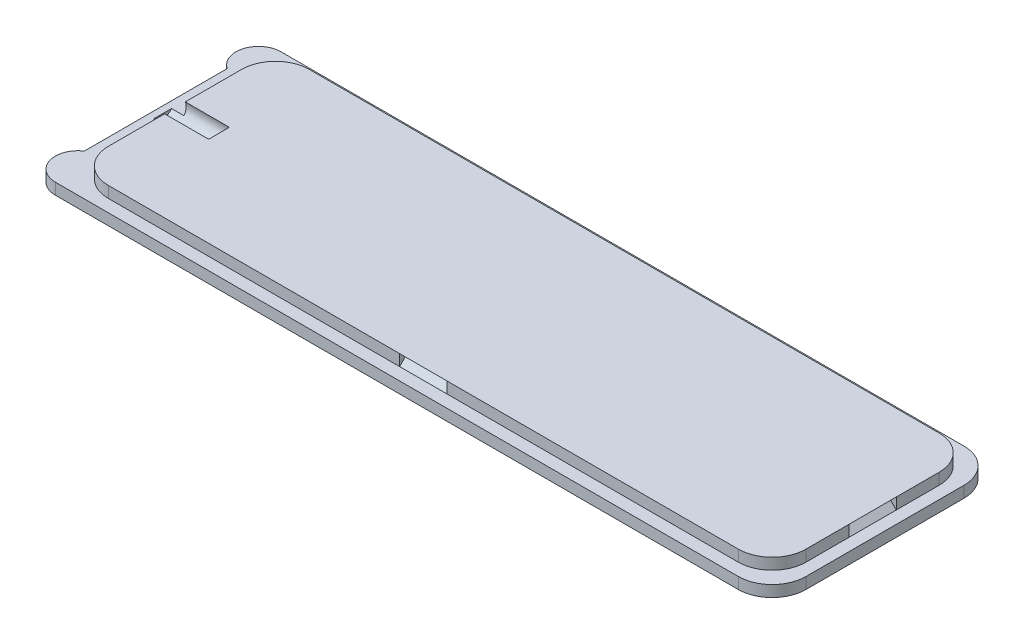
from build123d import *

# Parameters (mm, degrees)
BOSS_EXTRUDE1_DEPTH     = 10
CUT_EXTRUDE7_START      = -5
CUT_EXTRUDE7_DEPTH      = 5
CUT_EXTRUDE8_DEPTH      = 10.5
CUT_EXTRUDE8_DEPTH_BACK = 10.5
CUT_EXTRUDE9_DEPTH      = 10.5
CUT_EXTRUDE9_DEPTH_BACK = 10.5
SKETCH14_R              = 5
CUT_EXTRUDE10_DEPTH     = 25
BOSS_EXTRUDE2_DEPTH     = 5
CUT_EXTRUDE12_DEPTH     = 5


with BuildPart() as part:
    # Sketch8 → Boss-Extrude1 (new body)
    with BuildSketch(Plane(origin=(0, 0, 0), x_dir=(1, 0, 0), z_dir=(0, 1, 0))):
        with BuildLine():
            Line((15, 0), (305, 0))
            ThreePointArc((305, 0), (315.606601718, 4.393398282), (320, 15))
            Line((320, 15), (320, 85))
            ThreePointArc((320, 85), (315.606601718, 95.606601718), (305, 100))
            Line((305, 100), (15, 100))
            ThreePointArc((15, 100), (4.393398282, 95.606601718), (0, 85))
            Line((0, 85), (0, 15))
            ThreePointArc((0, 15), (4.393398282, 4.393398282), (15, 0))
        make_face()
    extrude(amount=BOSS_EXTRUDE1_DEPTH)

    # Sketch9 → Cut-Extrude7 (cut)
    with BuildSketch(Plane(origin=(0, 10, 0), x_dir=(1, 0, 0), z_dir=(0, 1, 0)).offset(CUT_EXTRUDE7_START)):
        with BuildLine():
            Line((15, 0), (305, 0))
            ThreePointArc((305, 0), (315.606601718, 4.393398282), (320, 15))
            Line((320, 15), (320, 85))
            ThreePointArc((320, 85), (315.606601718, 95.606601718), (305, 100))
            Line((305, 100), (15, 100))
            ThreePointArc((15, 100), (4.393398282, 95.606601718), (0, 85))
            Line((0, 85), (0, 15))
            ThreePointArc((0, 15), (4.393398282, 4.393398282), (15, 0))
        make_face()
        with BuildLine():
            Line((20.5, 94.5), (299.5, 94.5))
            ThreePointArc((299.5, 94.5), (310.106601718, 90.106601718), (314.5, 79.5))
            Line((314.5, 79.5), (314.5, 20.5))
            ThreePointArc((314.5, 20.5), (310.106601718, 9.893398282), (299.5, 5.5))
            Line((299.5, 5.5), (20.5, 5.5))
            ThreePointArc((20.5, 5.5), (9.893398282, 9.893398282), (5.5, 20.5))
            Line((5.5, 20.5), (5.5, 79.5))
            ThreePointArc((5.5, 79.5), (9.893398282, 90.106601718), (20.5, 94.5))
        make_face(mode=Mode.SUBTRACT)
    extrude(amount=CUT_EXTRUDE7_DEPTH, mode=Mode.SUBTRACT)

    # Sketch11 → Cut-Extrude8 (cut, two sides: drawn at the far end of the back side and taken through both)
    with BuildSketch(Plane(origin=(160, 0, 0), x_dir=(0, 0, -1), z_dir=(1, 0, 0)).offset(-CUT_EXTRUDE8_DEPTH_BACK)):
        Polygon((5.5, 10), (5.5, 5), (8, 7.5), align=None)
        Polygon((94.5, 10), (94.5, 5), (92, 7.5), align=None)
    extrude(amount=CUT_EXTRUDE8_DEPTH + CUT_EXTRUDE8_DEPTH_BACK, mode=Mode.SUBTRACT)

    # Sketch13 → Cut-Extrude9 (cut, two sides: drawn at the far end of the back side and taken through both)
    with BuildSketch(Plane.XY.offset(-50).offset(-CUT_EXTRUDE9_DEPTH_BACK)):
        Polygon((314.5, 5), (314.5, 10), (312, 7.5), align=None)
    extrude(amount=CUT_EXTRUDE9_DEPTH + CUT_EXTRUDE9_DEPTH_BACK, mode=Mode.SUBTRACT)

    # Sketch14 → Cut-Extrude10 (cut)
    with BuildSketch(Plane(origin=(0, 0, 0), x_dir=(0, 0, -1), z_dir=(1, 0, 0))):
        with Locations((50, 8)):
            Circle(SKETCH14_R)
    extrude(amount=CUT_EXTRUDE10_DEPTH, mode=Mode.SUBTRACT)

    # Sketch15 → Boss-Extrude2 (add)
    with BuildSketch(Plane(origin=(0, 0, 0), x_dir=(1, 0, 0), z_dir=(0, 1, 0))):
        with BuildLine():
            Line((-7.5, 100), (-7.5, 0))
            Line((-7.5, 0), (15, 0))
            ThreePointArc((15, 0), (4.393398282, 4.393398282), (0, 15))
            Line((0, 15), (0, 85))
            ThreePointArc((0, 85), (4.393398282, 95.606601718), (15, 100))
            Line((15, 100), (-7.5, 100))
        make_face()
    extrude(amount=BOSS_EXTRUDE2_DEPTH)

    # Sketch16 → Cut-Extrude12 (cut)
    with BuildSketch(Plane(origin=(0, 0, 0), x_dir=(1, 0, 0), z_dir=(0, 1, 0))):
        with BuildLine():
            Line((2.5, 0), (-7.5, 0))
            Line((-7.5, 0), (-7.5, 10))
            ThreePointArc((-7.5, 10), (-4.571067812, 2.928932188), (2.5, 0))
        make_face()
        with BuildLine():
            ThreePointArc((-3, 81.648353456), (-6.303408431, 85.25658351), (-7.5, 90))
            Line((-7.5, 90), (-7.5, 10))
            ThreePointArc((-7.5, 10), (-6.303408431, 14.74341649), (-3, 18.351646544))
            Line((-3, 18.351646544), (-3, 50))
            Line((-3, 50), (-3, 81.648353456))
        make_face()
        with BuildLine():
            Line((-7.5, 90), (-7.5, 100))
            Line((-7.5, 100), (2.5, 100))
            ThreePointArc((2.5, 100), (-4.571067812, 97.071067812), (-7.5, 90))
        make_face()
    extrude(amount=CUT_EXTRUDE12_DEPTH, mode=Mode.SUBTRACT)


solid = part.part
